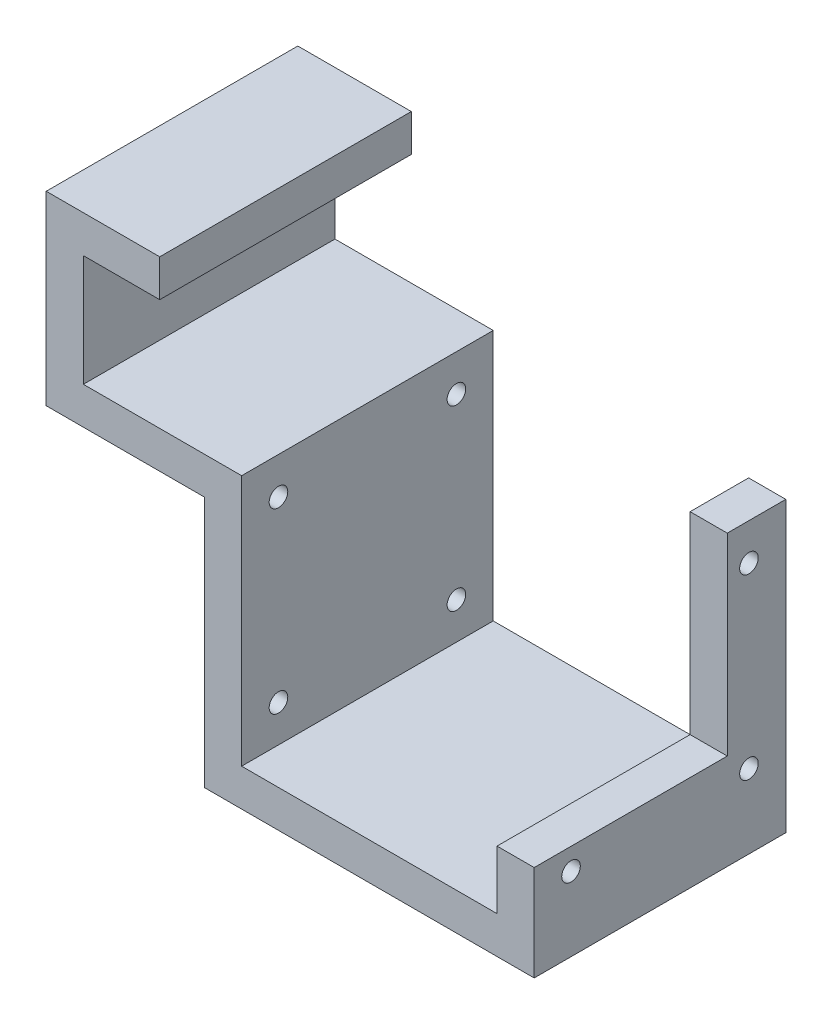
from build123d import *

# Parameters (mm, degrees)
BOSS_EXTRUDE1_DEPTH     = 43
SKETCH2_W               = 33
SKETCH2_H               = 6.35
SKETCH2_H_2             = 10
SKETCH2_R               = 1.5
SKETCH2_W_2             = 10
BOSS_EXTRUDE2_DEPTH     = 6.35
CUT_EXTRUDE1_DEPTH      = 85.993720356
CUT_EXTRUDE1_DEPTH_BACK = 12.7
SKETCH3_R               = 1.5875


with BuildPart() as part:
    # Sketch1 → Boss-Extrude1 (new body)
    with BuildSketch(Plane.XY):
        Polygon((-6.35, -27.85), (-6.35, 15.15), (-33.4, 15.15), (-33.4, 46.9), (-14, 46.9), (-14, 40.55), (-27.05, 40.55), (-27.05, 21.5), (0, 21.5), (0, -21.5), (43.65, -21.5), (43.65, -27.85), align=None)
    extrude(amount=-BOSS_EXTRUDE1_DEPTH)

    # Sketch2 → Boss-Extrude2 (add)
    # profile 1 of 4: a face of its own
    with BuildSketch(Plane(origin=(43.65, 0, 0), x_dir=(0, 0, -1), z_dir=(1, 0, 0))):
        with Locations((16.5, -24.675)):
            Rectangle(SKETCH2_W, SKETCH2_H)
    # profile 2 of 4: a face of its own
    with BuildSketch(Plane(origin=(43.65, 0, 0), x_dir=(0, 0, -1), z_dir=(1, 0, 0))):
        with Locations((16.5, -16.5)):
            Rectangle(SKETCH2_W, SKETCH2_H_2)
        with Locations((6.294174233, -15.205825767)):
            Circle(SKETCH2_R, mode=Mode.SUBTRACT)
    # profile 3 of 4: a face of its own
    with BuildSketch(Plane(origin=(43.65, 0, 0), x_dir=(0, 0, -1), z_dir=(1, 0, 0))):
        with Locations((38, -24.675)):
            Rectangle(SKETCH2_W_2, SKETCH2_H)
    # profile 4 of 4: a face of its own
    with BuildSketch(Plane(origin=(43.65, 0, 0), x_dir=(0, 0, -1), z_dir=(1, 0, 0))):
        Polygon((33, -11.5), (33, -21.5), (43, -21.5), (43, 21.5), (33, 21.5), align=None)
        with Locations((36.705825767, -15.205825767)):
            Circle(SKETCH2_R, mode=Mode.SUBTRACT)
        with Locations((36.705825767, 15.205825767)):
            Circle(SKETCH2_R, mode=Mode.SUBTRACT)
    extrude(amount=BOSS_EXTRUDE2_DEPTH)

    # Sketch3 → Cut-Extrude1 (cut, two sides: drawn at the far end of the back side and taken through both)
    with BuildSketch(Plane(origin=(-6.35, 0, 0), x_dir=(0, 0, -1), z_dir=(1, 0, 0)).offset(-CUT_EXTRUDE1_DEPTH_BACK)):
        with Locations(Location((6.294174233, -15.205825767, 0), (0, 0, 270))):
            Circle(SKETCH3_R)
        with Locations(Location((6.294174233, 15.205825767, 0), (0, 0, 270))):
            Circle(SKETCH3_R)
        with Locations(Location((36.705825767, 15.205825767, 0), (0, 0, 270))):
            Circle(SKETCH3_R)
        with Locations(Location((36.705825767, -15.205825767, 0), (0, 0, 270))):
            Circle(SKETCH3_R)
    extrude(amount=CUT_EXTRUDE1_DEPTH + CUT_EXTRUDE1_DEPTH_BACK, mode=Mode.SUBTRACT)


solid = part.part
